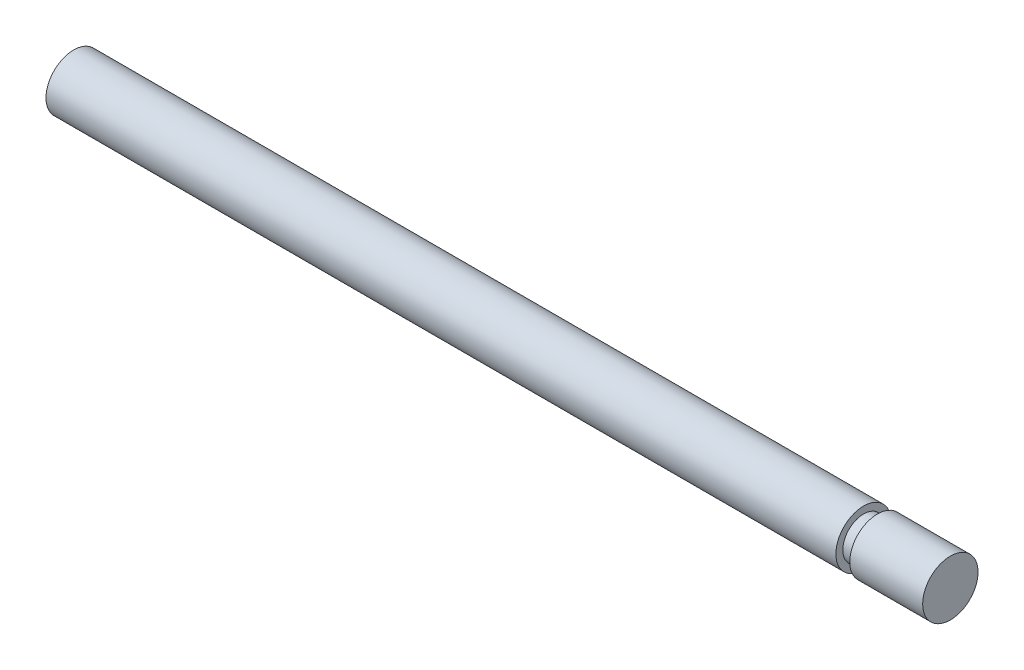
from build123d import *


with BuildPart() as part:
    # Sketch1 → Revolve1 (revolve)
    with BuildSketch(Plane.XY, mode=Mode.PRIVATE) as revolve1_sk:
        Polygon((0, 0), (0, 50), (1426.3, 50), (1426.3, 37.5), (1451.3, 37.5), (1451.3, 50), (1583, 50), (1583, 0), align=None)
    revolve(revolve1_sk.sketch.rotate(Axis((0, 0, 0), (1, 0, 0)), 90), axis=Axis((0, 0, 0), (1, 0, 0)))


solid = part.part
